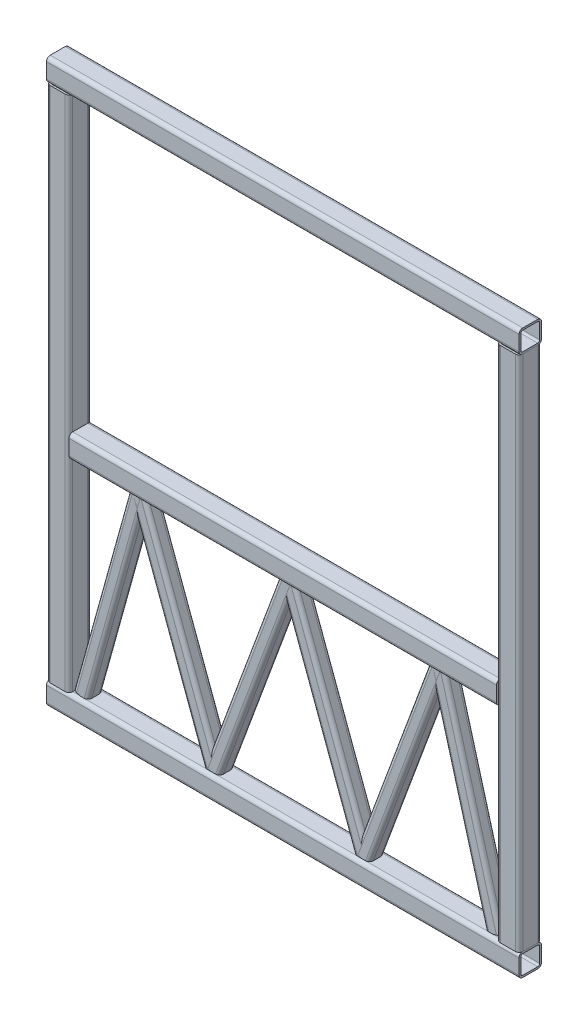
from build123d import *

# Parameters (mm, degrees)
STRUCTURAL_MEMBER5_DEPTH      = 1562.1
STRUCTURAL_MEMBER5_DEPTH_BACK = 38.1
STRUCTURAL_MEMBER5_2_DEPTH    = 1600.2
STRUCTURAL_MEMBER5_3_DEPTH    = 1830.8
STRUCTURAL_MEMBER5_4_DEPTH    = 1830.8
STRUCTURAL_MEMBER5_5_DEPTH    = 1526
STRUCTURAL_MEMBER6_DEPTH      = 711.766738475
STRUCTURAL_MEMBER6_2_DEPTH    = 731.325946484
STRUCTURAL_MEMBER6_3_DEPTH    = 731.325946484
STRUCTURAL_MEMBER6_4_DEPTH    = 731.325946484
STRUCTURAL_MEMBER6_5_DEPTH    = 731.325946484
STRUCTURAL_MEMBER6_6_DEPTH    = 711.766738475


with BuildPart() as part:
    # Sketch111 → Structural Member5 (new, two sides: drawn at the far end of the back side and taken through both)
    with BuildSketch(Plane.YZ.offset(-STRUCTURAL_MEMBER5_DEPTH_BACK)):
        with BuildLine():
            Line((-25.4, -38.1), (25.4, -38.1))
            ThreePointArc((25.4, -38.1), (34.380256121, -34.380256121), (38.1, -25.4))
            Line((38.1, -25.4), (38.1, 25.4))
            ThreePointArc((38.1, 25.4), (34.380256121, 34.380256121), (25.4, 38.1))
            Line((25.4, 38.1), (-25.4, 38.1))
            ThreePointArc((-25.4, 38.1), (-34.380256121, 34.380256121), (-38.1, 25.4))
            Line((-38.1, 25.4), (-38.1, -25.4))
            ThreePointArc((-38.1, -25.4), (-34.380256121, -34.380256121), (-25.4, -38.1))
        make_face()
        with BuildLine():
            Line((-25.4, -31.75), (25.4, -31.75))
            ThreePointArc((25.4, -31.75), (29.890128061, -29.890128061), (31.75, -25.4))
            Line((31.75, -25.4), (31.75, 25.4))
            ThreePointArc((31.75, 25.4), (29.890128061, 29.890128061), (25.4, 31.75))
            Line((25.4, 31.75), (-25.4, 31.75))
            ThreePointArc((-25.4, 31.75), (-29.890128061, 29.890128061), (-31.75, 25.4))
            Line((-31.75, 25.4), (-31.75, -25.4))
            ThreePointArc((-31.75, -25.4), (-29.890128061, -29.890128061), (-25.4, -31.75))
        make_face(mode=Mode.SUBTRACT)
    extrude(amount=STRUCTURAL_MEMBER5_DEPTH + STRUCTURAL_MEMBER5_DEPTH_BACK)


with BuildPart() as body_2:
    # Sketch111 on segment 2 (carried to segment 2) → Structural Member5 2 (new body)
    with BuildSketch(Plane(origin=(-38.1, 1828.8, 0), x_dir=(0, 1, 0), z_dir=(1, 0, 0))):
        with BuildLine():
            Line((-25.4, -38.1), (25.4, -38.1))
            ThreePointArc((25.4, -38.1), (34.380256121, -34.380256121), (38.1, -25.4))
            Line((38.1, -25.4), (38.1, 25.4))
            ThreePointArc((38.1, 25.4), (34.380256121, 34.380256121), (25.4, 38.1))
            Line((25.4, 38.1), (-25.4, 38.1))
            ThreePointArc((-25.4, 38.1), (-34.380256121, 34.380256121), (-38.1, 25.4))
            Line((-38.1, 25.4), (-38.1, -25.4))
            ThreePointArc((-38.1, -25.4), (-34.380256121, -34.380256121), (-25.4, -38.1))
        make_face()
        with BuildLine():
            Line((-25.4, -31.75), (25.4, -31.75))
            ThreePointArc((25.4, -31.75), (29.890128061, -29.890128061), (31.75, -25.4))
            Line((31.75, -25.4), (31.75, 25.4))
            ThreePointArc((31.75, 25.4), (29.890128061, 29.890128061), (25.4, 31.75))
            Line((25.4, 31.75), (-25.4, 31.75))
            ThreePointArc((-25.4, 31.75), (-29.890128061, 29.890128061), (-31.75, 25.4))
            Line((-31.75, 25.4), (-31.75, -25.4))
            ThreePointArc((-31.75, -25.4), (-29.890128061, -29.890128061), (-25.4, -31.75))
        make_face(mode=Mode.SUBTRACT)
    extrude(amount=STRUCTURAL_MEMBER5_2_DEPTH)


with BuildPart() as body_3:
    # Sketch111 on segment 3 (carried to segment 3) → Structural Member5 3 (new body)
    with BuildSketch(Plane.XZ.offset(-1829.8)):
        with BuildLine():
            Line((-25.4, -38.1), (25.4, -38.1))
            ThreePointArc((25.4, -38.1), (34.380256121, -34.380256121), (38.1, -25.4))
            Line((38.1, -25.4), (38.1, 25.4))
            ThreePointArc((38.1, 25.4), (34.380256121, 34.380256121), (25.4, 38.1))
            Line((25.4, 38.1), (-25.4, 38.1))
            ThreePointArc((-25.4, 38.1), (-34.380256121, 34.380256121), (-38.1, 25.4))
            Line((-38.1, 25.4), (-38.1, -25.4))
            ThreePointArc((-38.1, -25.4), (-34.380256121, -34.380256121), (-25.4, -38.1))
        make_face()
        with BuildLine():
            Line((-25.4, -31.75), (25.4, -31.75))
            ThreePointArc((25.4, -31.75), (29.890128061, -29.890128061), (31.75, -25.4))
            Line((31.75, -25.4), (31.75, 25.4))
            ThreePointArc((31.75, 25.4), (29.890128061, 29.890128061), (25.4, 31.75))
            Line((25.4, 31.75), (-25.4, 31.75))
            ThreePointArc((-25.4, 31.75), (-29.890128061, 29.890128061), (-31.75, 25.4))
            Line((-31.75, 25.4), (-31.75, -25.4))
            ThreePointArc((-31.75, -25.4), (-29.890128061, -29.890128061), (-25.4, -31.75))
        make_face(mode=Mode.SUBTRACT)
    extrude(amount=STRUCTURAL_MEMBER5_3_DEPTH)

    # Structural Member5 3 end butt 1
    split(bisect_by=Plane.XZ.offset(-1790.7), keep=Keep.TOP)

    # Structural Member5 3 end butt 2
    split(bisect_by=Plane(origin=(0, 38.1, 0), x_dir=(-1, 0, 0), z_dir=(0, 1, 0)), keep=Keep.TOP)


with BuildPart() as body_4:
    # Sketch111 on segment 4 (carried to segment 4) → Structural Member5 4 (new body)
    with BuildSketch(Plane(origin=(1524, -1, 0), x_dir=(-1, 0, 0), z_dir=(0, 1, 0))):
        with BuildLine():
            Line((-25.4, -38.1), (25.4, -38.1))
            ThreePointArc((25.4, -38.1), (34.380256121, -34.380256121), (38.1, -25.4))
            Line((38.1, -25.4), (38.1, 25.4))
            ThreePointArc((38.1, 25.4), (34.380256121, 34.380256121), (25.4, 38.1))
            Line((25.4, 38.1), (-25.4, 38.1))
            ThreePointArc((-25.4, 38.1), (-34.380256121, 34.380256121), (-38.1, 25.4))
            Line((-38.1, 25.4), (-38.1, -25.4))
            ThreePointArc((-38.1, -25.4), (-34.380256121, -34.380256121), (-25.4, -38.1))
        make_face()
        with BuildLine():
            Line((-25.4, -31.75), (25.4, -31.75))
            ThreePointArc((25.4, -31.75), (29.890128061, -29.890128061), (31.75, -25.4))
            Line((31.75, -25.4), (31.75, 25.4))
            ThreePointArc((31.75, 25.4), (29.890128061, 29.890128061), (25.4, 31.75))
            Line((25.4, 31.75), (-25.4, 31.75))
            ThreePointArc((-25.4, 31.75), (-29.890128061, 29.890128061), (-31.75, 25.4))
            Line((-31.75, 25.4), (-31.75, -25.4))
            ThreePointArc((-31.75, -25.4), (-29.890128061, -29.890128061), (-25.4, -31.75))
        make_face(mode=Mode.SUBTRACT)
    extrude(amount=STRUCTURAL_MEMBER5_4_DEPTH)

    # Structural Member5 4 end butt 1
    split(bisect_by=Plane(origin=(1524, 38.1, 0), x_dir=(-1, 0, 0), z_dir=(0, 1, 0)), keep=Keep.TOP)

    # Structural Member5 4 end butt 2
    split(bisect_by=Plane(origin=(1524, 1790.7, 0), x_dir=(1, 0, 0), z_dir=(0, -1, 0)), keep=Keep.TOP)


with BuildPart() as body_5:
    # Sketch111 on segment 5 (carried to segment 5) → Structural Member5 5 (new body)
    with BuildSketch(Plane(origin=(-1, 762, 0), x_dir=(0, 1, 0), z_dir=(1, 0, 0))):
        with BuildLine():
            Line((-25.4, -38.1), (25.4, -38.1))
            ThreePointArc((25.4, -38.1), (34.380256121, -34.380256121), (38.1, -25.4))
            Line((38.1, -25.4), (38.1, 25.4))
            ThreePointArc((38.1, 25.4), (34.380256121, 34.380256121), (25.4, 38.1))
            Line((25.4, 38.1), (-25.4, 38.1))
            ThreePointArc((-25.4, 38.1), (-34.380256121, 34.380256121), (-38.1, 25.4))
            Line((-38.1, 25.4), (-38.1, -25.4))
            ThreePointArc((-38.1, -25.4), (-34.380256121, -34.380256121), (-25.4, -38.1))
        make_face()
        with BuildLine():
            Line((-25.4, -31.75), (25.4, -31.75))
            ThreePointArc((25.4, -31.75), (29.890128061, -29.890128061), (31.75, -25.4))
            Line((31.75, -25.4), (31.75, 25.4))
            ThreePointArc((31.75, 25.4), (29.890128061, 29.890128061), (25.4, 31.75))
            Line((25.4, 31.75), (-25.4, 31.75))
            ThreePointArc((-25.4, 31.75), (-29.890128061, 29.890128061), (-31.75, 25.4))
            Line((-31.75, 25.4), (-31.75, -25.4))
            ThreePointArc((-31.75, -25.4), (-29.890128061, -29.890128061), (-25.4, -31.75))
        make_face(mode=Mode.SUBTRACT)
    extrude(amount=STRUCTURAL_MEMBER5_5_DEPTH)

    # Structural Member5 5 end butt 1
    split(bisect_by=Plane(origin=(38.1, 762, 0), x_dir=(0, 1, 0), z_dir=(1, 0, 0)), keep=Keep.TOP)

    # Structural Member5 5 end butt 2
    split(bisect_by=Plane(origin=(1485.9, 762, 0), x_dir=(0, -1, 0), z_dir=(-1, 0, 0)), keep=Keep.TOP)


with BuildPart() as body_6:
    # Sketch113 on segment 1 (carried to segment 1) → Structural Member6 (new body)
    with BuildSketch(Plane(origin=(1460.5, 38.1, 0), x_dir=(-0.96351791, -0.267643864, 0), z_dir=(-0.267643864, 0.96351791, 0))):
        with BuildLine():
            Line((-12.7, -25.4), (12.7, -25.4))
            ThreePointArc((12.7, -25.4), (21.680256121, -21.680256121), (25.4, -12.7))
            Line((25.4, -12.7), (25.4, 12.7))
            ThreePointArc((25.4, 12.7), (21.680256121, 21.680256121), (12.7, 25.4))
            Line((12.7, 25.4), (-12.7, 25.4))
            ThreePointArc((-12.7, 25.4), (-21.680256121, 21.680256121), (-25.4, 12.7))
            Line((-25.4, 12.7), (-25.4, -12.7))
            ThreePointArc((-25.4, -12.7), (-21.680256121, -21.680256121), (-12.7, -25.4))
        make_face()
        with BuildLine():
            Line((-12.7, -19.05), (12.7, -19.05))
            ThreePointArc((12.7, -19.05), (17.190128061, -17.190128061), (19.05, -12.7))
            Line((19.05, -12.7), (19.05, 12.7))
            ThreePointArc((19.05, 12.7), (17.190128061, 17.190128061), (12.7, 19.05))
            Line((12.7, 19.05), (-12.7, 19.05))
            ThreePointArc((-12.7, 19.05), (-17.190128061, 17.190128061), (-19.05, 12.7))
            Line((-19.05, 12.7), (-19.05, -12.7))
            ThreePointArc((-19.05, -12.7), (-17.190128061, -17.190128061), (-12.7, -19.05))
        make_face(mode=Mode.SUBTRACT)
    extrude(amount=STRUCTURAL_MEMBER6_DEPTH)


with BuildPart() as body_7:
    # Sketch113 on segment 2 (carried to segment 2) → Structural Member6 2 (new body)
    with BuildSketch(Plane(origin=(1270, 723.9, 0), x_dir=(0.937748761, -0.347314356, 0), z_dir=(-0.347314356, -0.937748761, 0))):
        with BuildLine():
            Line((-12.7, -25.4), (12.7, -25.4))
            ThreePointArc((12.7, -25.4), (21.680256121, -21.680256121), (25.4, -12.7))
            Line((25.4, -12.7), (25.4, 12.7))
            ThreePointArc((25.4, 12.7), (21.680256121, 21.680256121), (12.7, 25.4))
            Line((12.7, 25.4), (-12.7, 25.4))
            ThreePointArc((-12.7, 25.4), (-21.680256121, 21.680256121), (-25.4, 12.7))
            Line((-25.4, 12.7), (-25.4, -12.7))
            ThreePointArc((-25.4, -12.7), (-21.680256121, -21.680256121), (-12.7, -25.4))
        make_face()
        with BuildLine():
            Line((-12.7, -19.05), (12.7, -19.05))
            ThreePointArc((12.7, -19.05), (17.190128061, -17.190128061), (19.05, -12.7))
            Line((19.05, -12.7), (19.05, 12.7))
            ThreePointArc((19.05, 12.7), (17.190128061, 17.190128061), (12.7, 19.05))
            Line((12.7, 19.05), (-12.7, 19.05))
            ThreePointArc((-12.7, 19.05), (-17.190128061, 17.190128061), (-19.05, 12.7))
            Line((-19.05, 12.7), (-19.05, -12.7))
            ThreePointArc((-19.05, -12.7), (-17.190128061, -17.190128061), (-12.7, -19.05))
        make_face(mode=Mode.SUBTRACT)
    extrude(amount=STRUCTURAL_MEMBER6_2_DEPTH)


with BuildPart() as body_8:
    # Sketch113 on segment 3 (carried to segment 3) → Structural Member6 3 (new body)
    with BuildSketch(Plane(origin=(1016, 38.1, 0), x_dir=(-0.937748761, -0.347314356, 0), z_dir=(-0.347314356, 0.937748761, 0))):
        with BuildLine():
            Line((-12.7, -25.4), (12.7, -25.4))
            ThreePointArc((12.7, -25.4), (21.680256121, -21.680256121), (25.4, -12.7))
            Line((25.4, -12.7), (25.4, 12.7))
            ThreePointArc((25.4, 12.7), (21.680256121, 21.680256121), (12.7, 25.4))
            Line((12.7, 25.4), (-12.7, 25.4))
            ThreePointArc((-12.7, 25.4), (-21.680256121, 21.680256121), (-25.4, 12.7))
            Line((-25.4, 12.7), (-25.4, -12.7))
            ThreePointArc((-25.4, -12.7), (-21.680256121, -21.680256121), (-12.7, -25.4))
        make_face()
        with BuildLine():
            Line((-12.7, -19.05), (12.7, -19.05))
            ThreePointArc((12.7, -19.05), (17.190128061, -17.190128061), (19.05, -12.7))
            Line((19.05, -12.7), (19.05, 12.7))
            ThreePointArc((19.05, 12.7), (17.190128061, 17.190128061), (12.7, 19.05))
            Line((12.7, 19.05), (-12.7, 19.05))
            ThreePointArc((-12.7, 19.05), (-17.190128061, 17.190128061), (-19.05, 12.7))
            Line((-19.05, 12.7), (-19.05, -12.7))
            ThreePointArc((-19.05, -12.7), (-17.190128061, -17.190128061), (-12.7, -19.05))
        make_face(mode=Mode.SUBTRACT)
    extrude(amount=STRUCTURAL_MEMBER6_3_DEPTH)


with BuildPart() as body_9:
    # Sketch113 on segment 4 (carried to segment 4) → Structural Member6 4 (new body)
    with BuildSketch(Plane(origin=(762, 723.9, 0), x_dir=(0.937748761, -0.347314356, 0), z_dir=(-0.347314356, -0.937748761, 0))):
        with BuildLine():
            Line((-12.7, -25.4), (12.7, -25.4))
            ThreePointArc((12.7, -25.4), (21.680256121, -21.680256121), (25.4, -12.7))
            Line((25.4, -12.7), (25.4, 12.7))
            ThreePointArc((25.4, 12.7), (21.680256121, 21.680256121), (12.7, 25.4))
            Line((12.7, 25.4), (-12.7, 25.4))
            ThreePointArc((-12.7, 25.4), (-21.680256121, 21.680256121), (-25.4, 12.7))
            Line((-25.4, 12.7), (-25.4, -12.7))
            ThreePointArc((-25.4, -12.7), (-21.680256121, -21.680256121), (-12.7, -25.4))
        make_face()
        with BuildLine():
            Line((-12.7, -19.05), (12.7, -19.05))
            ThreePointArc((12.7, -19.05), (17.190128061, -17.190128061), (19.05, -12.7))
            Line((19.05, -12.7), (19.05, 12.7))
            ThreePointArc((19.05, 12.7), (17.190128061, 17.190128061), (12.7, 19.05))
            Line((12.7, 19.05), (-12.7, 19.05))
            ThreePointArc((-12.7, 19.05), (-17.190128061, 17.190128061), (-19.05, 12.7))
            Line((-19.05, 12.7), (-19.05, -12.7))
            ThreePointArc((-19.05, -12.7), (-17.190128061, -17.190128061), (-12.7, -19.05))
        make_face(mode=Mode.SUBTRACT)
    extrude(amount=STRUCTURAL_MEMBER6_4_DEPTH)


with BuildPart() as body_10:
    # Sketch113 on segment 5 (carried to segment 5) → Structural Member6 5 (new body)
    with BuildSketch(Plane(origin=(508, 38.1, 0), x_dir=(-0.937748761, -0.347314356, 0), z_dir=(-0.347314356, 0.937748761, 0))):
        with BuildLine():
            Line((-12.7, -25.4), (12.7, -25.4))
            ThreePointArc((12.7, -25.4), (21.680256121, -21.680256121), (25.4, -12.7))
            Line((25.4, -12.7), (25.4, 12.7))
            ThreePointArc((25.4, 12.7), (21.680256121, 21.680256121), (12.7, 25.4))
            Line((12.7, 25.4), (-12.7, 25.4))
            ThreePointArc((-12.7, 25.4), (-21.680256121, 21.680256121), (-25.4, 12.7))
            Line((-25.4, 12.7), (-25.4, -12.7))
            ThreePointArc((-25.4, -12.7), (-21.680256121, -21.680256121), (-12.7, -25.4))
        make_face()
        with BuildLine():
            Line((-12.7, -19.05), (12.7, -19.05))
            ThreePointArc((12.7, -19.05), (17.190128061, -17.190128061), (19.05, -12.7))
            Line((19.05, -12.7), (19.05, 12.7))
            ThreePointArc((19.05, 12.7), (17.190128061, 17.190128061), (12.7, 19.05))
            Line((12.7, 19.05), (-12.7, 19.05))
            ThreePointArc((-12.7, 19.05), (-17.190128061, 17.190128061), (-19.05, 12.7))
            Line((-19.05, 12.7), (-19.05, -12.7))
            ThreePointArc((-19.05, -12.7), (-17.190128061, -17.190128061), (-12.7, -19.05))
        make_face(mode=Mode.SUBTRACT)
    extrude(amount=STRUCTURAL_MEMBER6_5_DEPTH)


with BuildPart() as body_11:
    # Sketch113 → Structural Member6 6 (new body)
    with BuildSketch(Plane(origin=(254, 723.9, 0), x_dir=(0.9635179096299407, -0.2676438637860945, 0), z_dir=(-0.2676438637860945, -0.9635179096299407, 0))):
        with BuildLine():
            Line((-12.7, -25.4), (12.7, -25.4))
            ThreePointArc((12.7, -25.4), (21.680256121, -21.680256121), (25.4, -12.7))
            Line((25.4, -12.7), (25.4, 12.7))
            ThreePointArc((25.4, 12.7), (21.680256121, 21.680256121), (12.7, 25.4))
            Line((12.7, 25.4), (-12.7, 25.4))
            ThreePointArc((-12.7, 25.4), (-21.680256121, 21.680256121), (-25.4, 12.7))
            Line((-25.4, 12.7), (-25.4, -12.7))
            ThreePointArc((-25.4, -12.7), (-21.680256121, -21.680256121), (-12.7, -25.4))
        make_face()
        with BuildLine():
            Line((-12.7, -19.05), (12.7, -19.05))
            ThreePointArc((12.7, -19.05), (17.190128061, -17.190128061), (19.05, -12.7))
            Line((19.05, -12.7), (19.05, 12.7))
            ThreePointArc((19.05, 12.7), (17.190128061, 17.190128061), (12.7, 19.05))
            Line((12.7, 19.05), (-12.7, 19.05))
            ThreePointArc((-12.7, 19.05), (-17.190128061, 17.190128061), (-19.05, 12.7))
            Line((-19.05, 12.7), (-19.05, -12.7))
            ThreePointArc((-19.05, -12.7), (-17.190128061, -17.190128061), (-12.7, -19.05))
        make_face(mode=Mode.SUBTRACT)
    extrude(amount=STRUCTURAL_MEMBER6_6_DEPTH)


solid = Compound([part.part, body_2.part, body_3.part, body_4.part, body_5.part, body_6.part, body_7.part, body_8.part, body_9.part, body_10.part, body_11.part])
